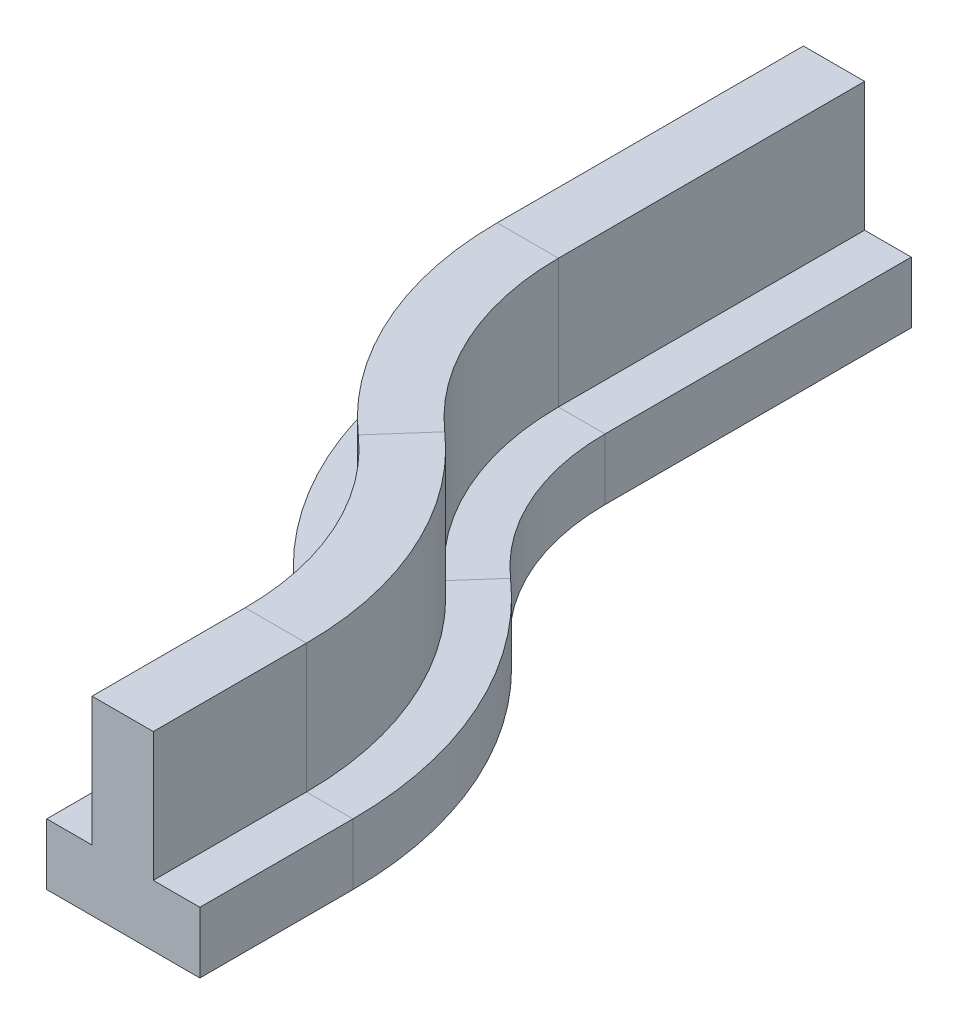
from build123d import *


with BuildPart() as part:
    # Sweep1: sweep along a path in Sketch3
    with BuildLine(Plane(origin=(0, 0, 0), x_dir=(1, 0, 0), z_dir=(0, 1, 0))) as sweep1_path:
        Line((12.5, 0), (12.5, 25))
        ThreePointArc((12.5, 25), (8.071891388, 45.571891388), (-4.428108612, 62.5))
        ThreePointArc((-4.428108612, 62.5), (-16.928108612, 79.428108612), (-21.356217223, 100))
        Line((-21.356217223, 100), (-21.356217223, 150))
    # Sketch1 → Sweep1 (sweep)
    with BuildSketch(Plane.XY):
        Polygon((17.394366197, 10), (25, 10), (25, 0), (0, 0), (0, 10), (7.394366197, 10), (7.394366197, 31.044600939), (17.394366197, 31.044600939), align=None)
    sweep(path=sweep1_path.line)


solid = part.part
